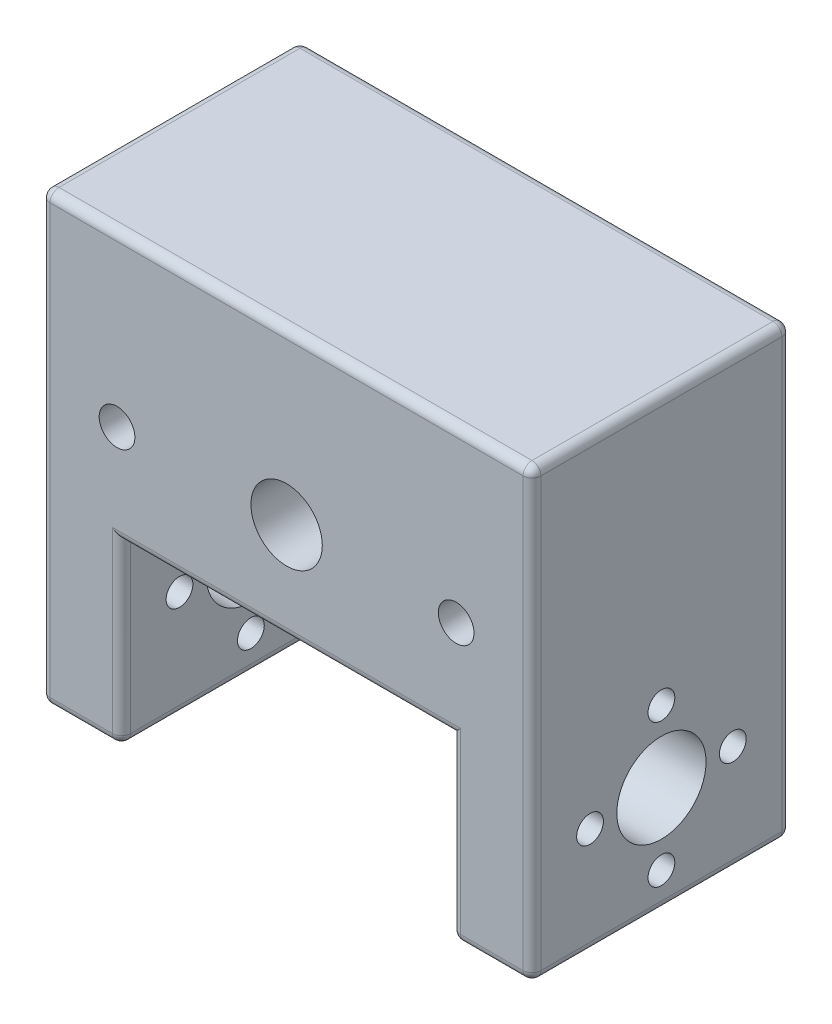
from build123d import *

# Parameters (mm, degrees)
BOSS_EXTRUDE1_DEPTH = 14.5
SKETCH2_R           = 5
SKETCH2_R_2         = 1.5
CUT_EXTRUDE1_DEPTH  = 63.130910182
SKETCH3_R           = 4
SKETCH3_R_2         = 2
CUT_EXTRUDE2_DEPTH  = 48.140746706
FILLET1_R           = 1


with BuildPart() as part:
    # Sketch1 → Boss-Extrude1 (new, symmetric)
    with BuildSketch(Plane.XY):
        Polygon((-27.5, -25), (-18.5, -25), (-18.5, -5), (18.5, -5), (18.5, -25), (27.5, -25), (27.5, 25), (-27.5, 25), align=None)
    extrude(amount=BOSS_EXTRUDE1_DEPTH, both=True)

    # Sketch2 → Cut-Extrude1 (cut, through all)
    with BuildSketch(Plane(origin=(27.5, 0, 0), x_dir=(0, 0, -1), z_dir=(1, 0, 0))):
        with Locations((0, -13)):
            Circle(SKETCH2_R)
        with Locations((0, -21)):
            Circle(SKETCH2_R_2)
        with Locations((-8, -13)):
            Circle(SKETCH2_R_2)
        with Locations((0, -5)):
            Circle(SKETCH2_R_2)
        with Locations((8, -13)):
            Circle(SKETCH2_R_2)
    extrude(amount=-CUT_EXTRUDE1_DEPTH, mode=Mode.SUBTRACT)

    # Sketch3 → Cut-Extrude2 (cut, through all)
    with BuildSketch(Plane.XY.offset(14.5)):
        with Locations((0, 6)):
            Circle(SKETCH3_R)
        with Locations((-19, 6)):
            Circle(SKETCH3_R_2)
        with Locations((19, 6)):
            Circle(SKETCH3_R_2)
    extrude(amount=-CUT_EXTRUDE2_DEPTH, mode=Mode.SUBTRACT)

    # Fillet1
    fillet1_edges = [part.edges().sort_by_distance(p)[0] for p in [
        (27.5, 25, 0),
        (0, 25, 14.5),
        (-27.5, 25, 0),
        (0, 25, -14.5),
        (-27.5, -25, 0),
        (-23, -25, 14.5),
        (-18.5, -25, 0),
        (-23, -25, -14.5),
        (18.5, -25, 0),
        (23, -25, 14.5),
        (27.5, -25, 0),
        (23, -25, -14.5),
        (0, -5, -14.5),
        (27.5, 0, -14.5),
        (27.5, 0, 14.5),
        (-27.5, 0, -14.5),
        (-27.5, 0, 14.5),
        (18.5, -15, -14.5),
        (-18.5, -15, -14.5),
        (-18.5, -15, 14.5),
        (18.5, -15, 14.5),
        (0, -5, 14.5),
    ]]
    fillet(fillet1_edges, radius=FILLET1_R)


solid = part.part
